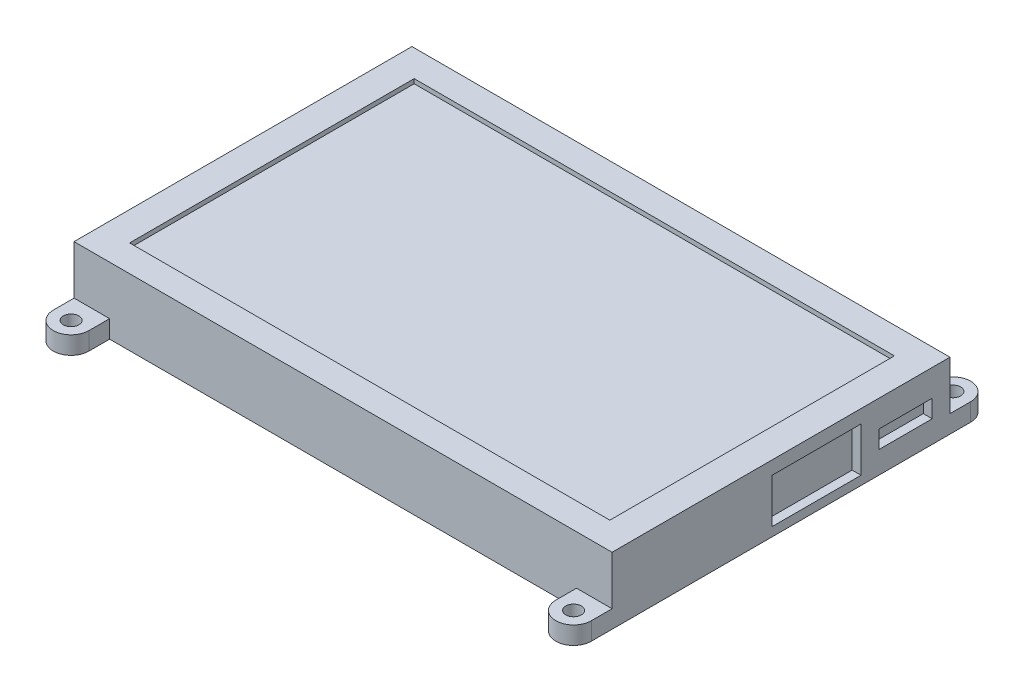
from build123d import *

# Parameters (mm, degrees)
SKETCH1_W           = 121
SKETCH1_H           = 75.99
BOSS_EXTRUDE1_DEPTH = 15
SKETCH2_W           = 108
SKETCH2_H           = 64
CUT_EXTRUDE1_DEPTH  = 1
BOSS_EXTRUDE2_DEPTH = 4
SKETCH4_R           = 1.75
CUT_EXTRUDE3_DEPTH  = 4
SKETCH5_W           = 12
SKETCH5_H           = 4
SKETCH5_W_2         = 20
SKETCH5_H_2         = 10
CUT_EXTRUDE4_DEPTH  = 2


with BuildPart() as part:
    # Sketch1 → Boss-Extrude1 (new body)
    with BuildSketch(Plane(origin=(0, 0, 0), x_dir=(1, 0, 0), z_dir=(0, 1, 0))):
        with Locations((60.5, 37.995)):
            Rectangle(SKETCH1_W, SKETCH1_H)
    extrude(amount=BOSS_EXTRUDE1_DEPTH)

    # Sketch2 → Cut-Extrude1 (cut)
    with BuildSketch(Plane(origin=(0, 15, 0), x_dir=(1, 0, 0), z_dir=(0, 1, 0))):
        with Locations((60.5, 37.995)):
            Rectangle(SKETCH2_W, SKETCH2_H)
    extrude(amount=-CUT_EXTRUDE1_DEPTH, mode=Mode.SUBTRACT)

    # Sketch3 → Boss-Extrude2 (add)
    with BuildSketch(Plane.XZ):
        with BuildLine():
            Line((0, -80.65), (0, -71.33))
            ThreePointArc((0, -71.33), (4, -67.33), (8, -71.33))
            Line((8, -71.33), (8, -80.65))
            ThreePointArc((8, -80.65), (4, -84.65), (0, -80.65))
        make_face()
        with BuildLine():
            Line((121, -80.65), (121, -71.33))
            ThreePointArc((121, -71.33), (117, -67.33), (113, -71.33))
            Line((113, -71.33), (113, -80.65))
            ThreePointArc((113, -80.65), (117, -84.65), (121, -80.65))
        make_face()
        with BuildLine():
            Line((0, 4.66), (0, -4.66))
            ThreePointArc((0, -4.66), (4, -8.66), (8, -4.66))
            Line((8, -4.66), (8, 4.66))
            ThreePointArc((8, 4.66), (4, 8.66), (0, 4.66))
        make_face()
        with BuildLine():
            Line((121, 4.66), (121, -4.66))
            ThreePointArc((121, -4.66), (117, -8.66), (113, -4.66))
            Line((113, -4.66), (113, 4.66))
            ThreePointArc((113, 4.66), (117, 8.66), (121, 4.66))
        make_face()
    extrude(amount=-BOSS_EXTRUDE2_DEPTH)

    # Sketch4 → Cut-Extrude3 (cut)
    with BuildSketch(Plane.XZ):
        with Locations(Location((4, -80.65, 0), (0, 0, 270))):
            Circle(SKETCH4_R)
        with Locations(Location((117, -80.65, 0), (0, 0, 90))):
            Circle(SKETCH4_R)
        with Locations(Location((4, 4.66, 0), (0, 0, 90))):
            Circle(SKETCH4_R)
        with Locations(Location((117, 4.66, 0), (0, 0, 270))):
            Circle(SKETCH4_R)
    extrude(amount=-CUT_EXTRUDE3_DEPTH, mode=Mode.SUBTRACT)

    # Sketch5 → Cut-Extrude4 (cut)
    with BuildSketch(Plane(origin=(121, 0, 0), x_dir=(0, 0, -1), z_dir=(1, 0, 0))):
        with Locations((65.99, 7)):
            Rectangle(SKETCH5_W, SKETCH5_H)
        with Locations((45.99, 7)):
            Rectangle(SKETCH5_W_2, SKETCH5_H_2)
    extrude(amount=-CUT_EXTRUDE4_DEPTH, mode=Mode.SUBTRACT)


solid = part.part
